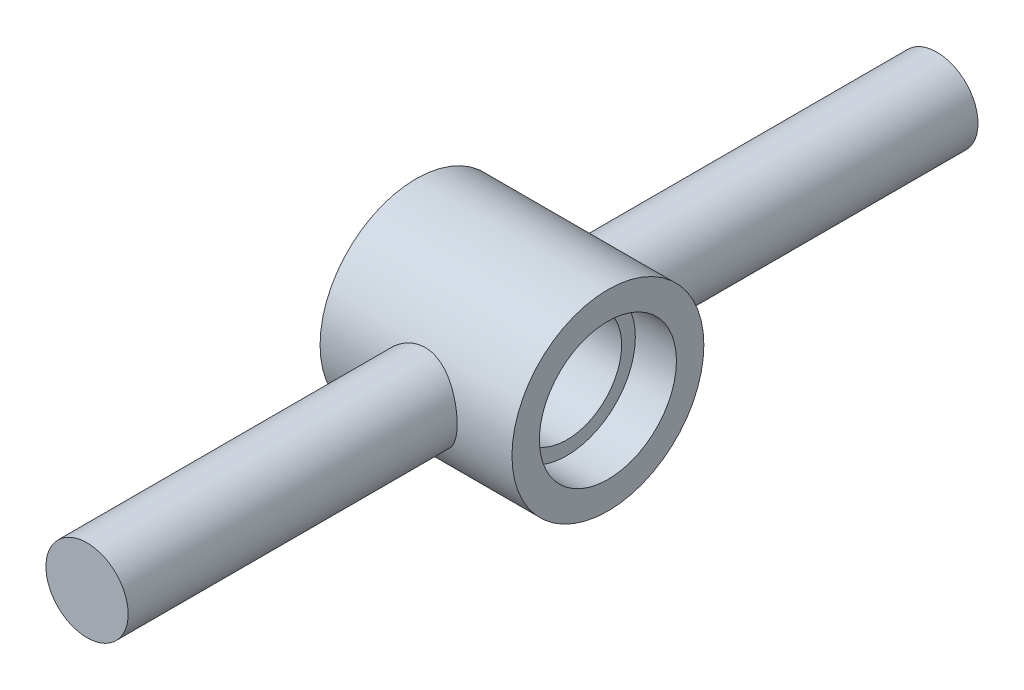
from build123d import *

# Parameters (mm, degrees)
SKETCH_1_W          = 14
SKETCH_1_H          = 7
SKETCH_2_W          = 62
SKETCH_2_H          = 3
SKETCH_3_R          = 4
CUT_EXTRUDE_1_DEPTH = 35.727510858
SKETCH_5_R          = 5
CUT_EXTRUDE_2_DEPTH = 3


with BuildPart() as part:
    # 草图1 → 旋转1 (revolve)
    with BuildSketch(Plane.XY, mode=Mode.PRIVATE) as revolve_1_sk:
        with Locations((0, 3.5)):
            Rectangle(SKETCH_1_W, SKETCH_1_H)
    revolve(revolve_1_sk.sketch.rotate(Axis((-7, 0, 0), (1, 0, 0)), 90), axis=Axis((-7, 0, 0), (1, 0, 0)))

    # 草图2 → 旋转3 (revolve)
    with BuildSketch(Plane(origin=(0, 0, 0), x_dir=(0, 0, -1), z_dir=(1, 0, 0)), mode=Mode.PRIVATE) as revolve_3_sk:
        with Locations((0, 1.5)):
            Rectangle(SKETCH_2_W, SKETCH_2_H)
    revolve(revolve_3_sk.sketch.rotate(Axis((0, 0, 31), (0, 0, -1)), 90), axis=Axis((0, 0, 31), (0, 0, -1)))

    # 草图3 → 切除-拉伸1 (cut, through all)
    with BuildSketch(Plane(origin=(7, 0, 0), x_dir=(0, 0, -1), z_dir=(1, 0, 0))):
        Circle(SKETCH_3_R)
    extrude(amount=-CUT_EXTRUDE_1_DEPTH, mode=Mode.SUBTRACT)

    # 草图5 → 切除-拉伸2 (cut)
    with BuildSketch(Plane(origin=(7, 0, 0), x_dir=(0, 0, -1), z_dir=(1, 0, 0))):
        Circle(SKETCH_5_R)
    cut_extrude_2 = extrude(amount=-CUT_EXTRUDE_2_DEPTH, mode=Mode.SUBTRACT)

    # 镜向1: 切除-拉伸2 across plane
    add(cut_extrude_2.mirror(Plane(origin=(0, 0, 0), x_dir=(0, 0, 1), z_dir=(1, 0, 0))), mode=Mode.SUBTRACT)


solid = part.part
